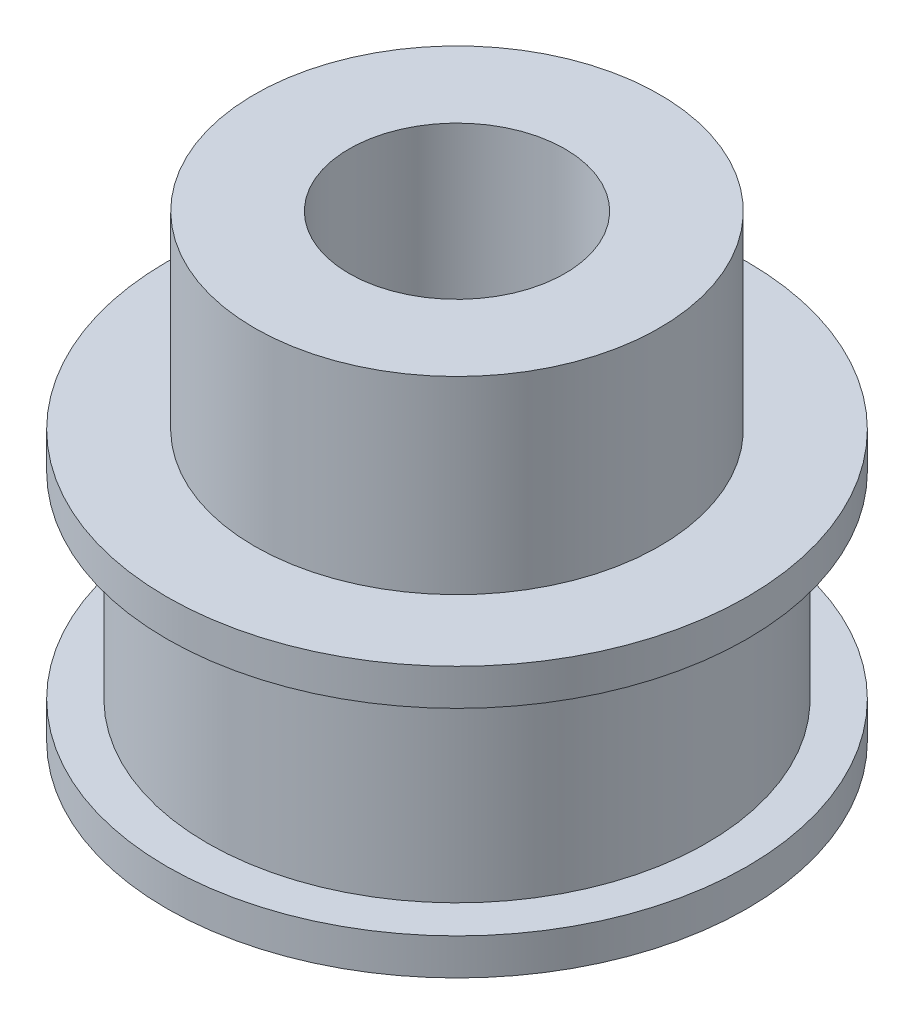
from build123d import *

# Parameters (mm, degrees)
SKETCH_1_R          = 10.75
EXTRUDE_1_DEPTH     = 1.35
SKETCH_4_R          = 9.25
EXTRUDE_3_DEPTH     = 7.3
EXTRUDE_START       = 8.65
SKETCH_1_4_R        = 10.75
EXTRUDE_4_DEPTH     = 1.35
SKETCH_6_R          = 7.5
EXTRUDE_5_DEPTH     = 7
SKETCH_5_R          = 4
CUT_EXTRUDE_1_DEPTH = 23.806249144


with BuildPart() as part:
    # 草图1 → 凸台-拉伸1 (new body)
    with BuildSketch(Plane(origin=(0, 0, 0), x_dir=(1, 0, 0), z_dir=(0, 1, 0))):
        with Locations(Location((0, 0, 0), (0, 0, 90))):
            Circle(SKETCH_1_R)
    extrude(amount=EXTRUDE_1_DEPTH)

    # 草图4 → 凸台-拉伸3 (add)
    with BuildSketch(Plane(origin=(0, 1.35, 0), x_dir=(1, 0, 0), z_dir=(0, 1, 0))):
        with Locations(Location((0, 0, 0), (0, 0, 270))):
            Circle(SKETCH_4_R)
    extrude(amount=EXTRUDE_3_DEPTH)

    # 草图1<4> → 凸台-拉伸4 (add)
    with BuildSketch(Plane(origin=(0, 0, 0), x_dir=(1, 0, 0), z_dir=(0, 1, 0)).offset(EXTRUDE_START)):
        with Locations(Location((0, 0, 0), (0, 0, 90))):
            Circle(SKETCH_1_4_R)
    extrude(amount=EXTRUDE_4_DEPTH)

    # 草图6 → 凸台-拉伸5 (add)
    with BuildSketch(Plane(origin=(0, 10, 0), x_dir=(1, 0, 0), z_dir=(0, 1, 0))):
        with Locations(Location((0, 0, 0), (0, 0, 270))):
            Circle(SKETCH_6_R)
    extrude(amount=EXTRUDE_5_DEPTH)

    # 草图5 → 切除-拉伸1 (cut, through all)
    with BuildSketch(Plane.XZ):
        with Locations(Location((0, 0, 0), (0, 0, 270))):
            Circle(SKETCH_5_R)
    extrude(amount=-CUT_EXTRUDE_1_DEPTH, mode=Mode.SUBTRACT)


solid = part.part
